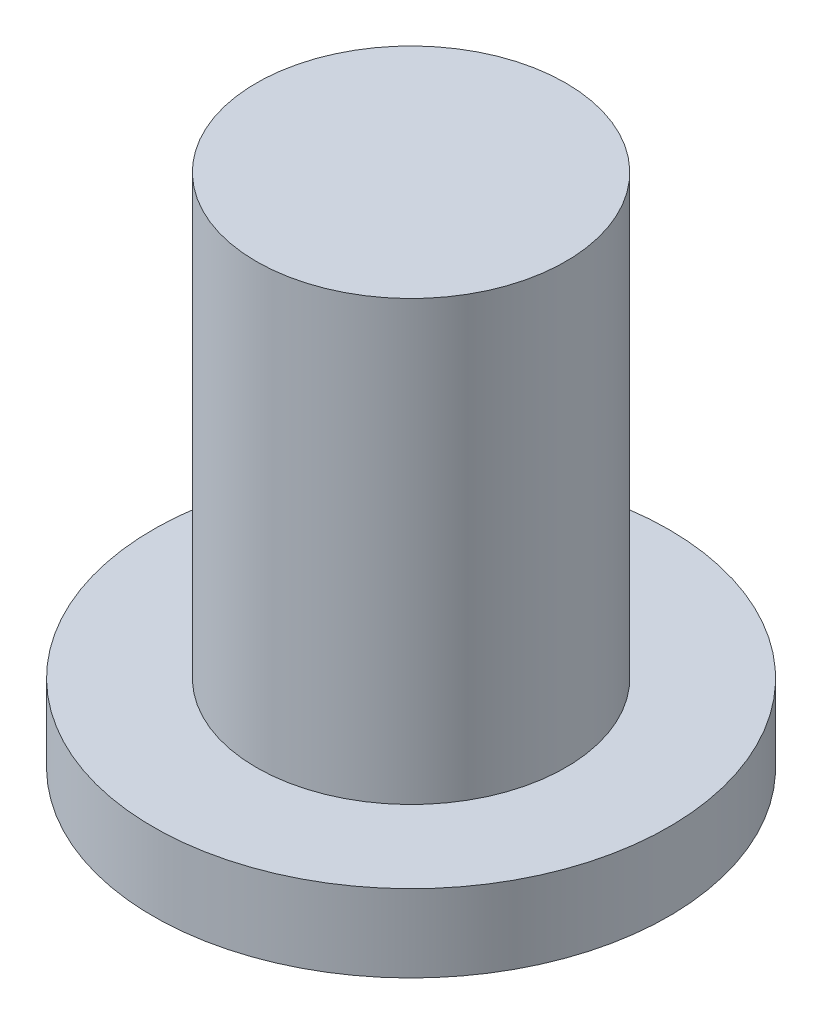
from build123d import *

# Parameters (mm, degrees)
SKETCH_1_R      = 6
EXTRUDE_1_DEPTH = 17
SKETCH_2_R      = 10
EXTRUDE_2_DEPTH = 3


with BuildPart() as part:
    # 草图1 → 凸台-拉伸1 (new body)
    with BuildSketch(Plane(origin=(0, 0, 0), x_dir=(1, 0, 0), z_dir=(0, 1, 0))):
        with Locations(Location((0, 0, 0), (0, 0, 270))):
            Circle(SKETCH_1_R)
    extrude(amount=EXTRUDE_1_DEPTH)

    # 草图2 → 凸台-拉伸2 (add)
    with BuildSketch(Plane.XZ):
        with Locations(Location((0, 0, 0), (0, 0, 270))):
            Circle(SKETCH_2_R)
    extrude(amount=EXTRUDE_2_DEPTH)


solid = part.part
